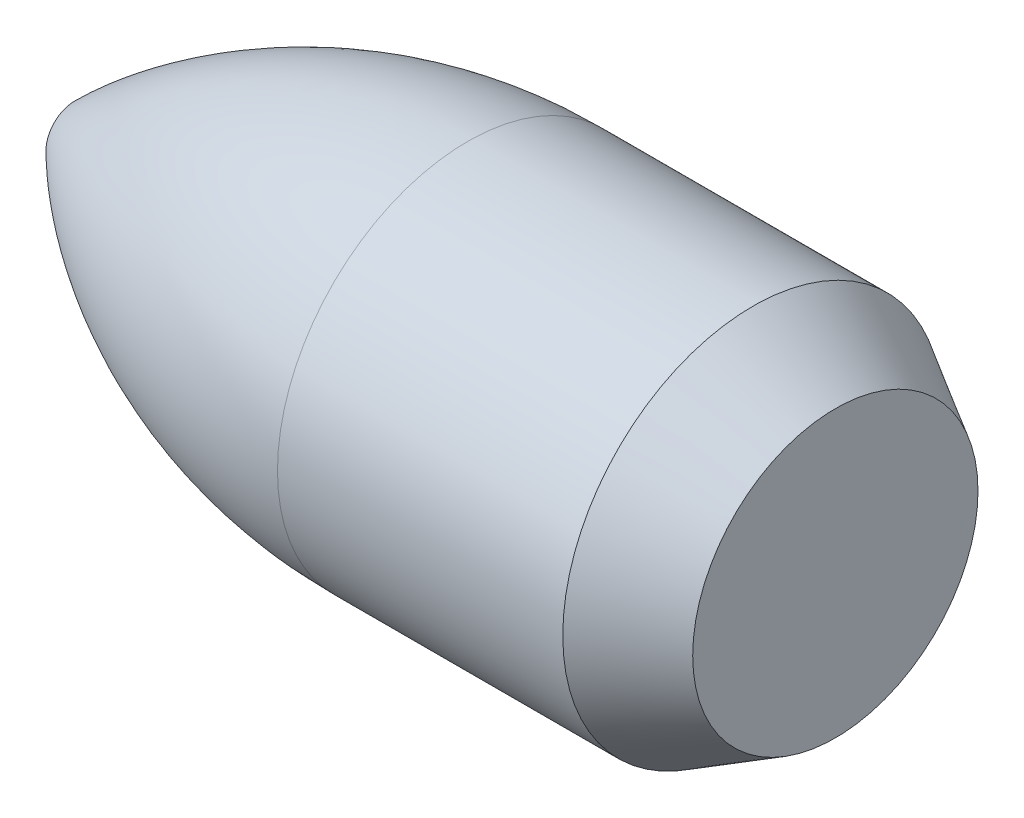
from build123d import *


with BuildPart() as part:
    # Эскиз1 → Повернуть1 (revolve)
    with BuildSketch(Plane.XY, mode=Mode.PRIVATE) as revolve_1_sk:
        with BuildLine():
            Line((0, 0), (0, 1.5))
            add(Edge.make_bspline(
                [(0, 1.5), (3.948927259, 5.448927259), (11.142105811, 10), (20.669872981, 10)],
                knots=[0, 0, 0, 0, 1, 1, 1, 1], degree=3))
            Line((20.669872981, 10), (35.669872981, 10))
            Line((35.669872981, 10), (40, 7.5))
            Line((40, 7.5), (40, 0))
            Line((40, 0), (0, 0))
        make_face()
    revolve(revolve_1_sk.sketch.rotate(Axis((-8.041904234, 0, 0), (1, 0, 0)), 90), axis=Axis((-8.041904234, 0, 0), (1, 0, 0)))


solid = part.part
